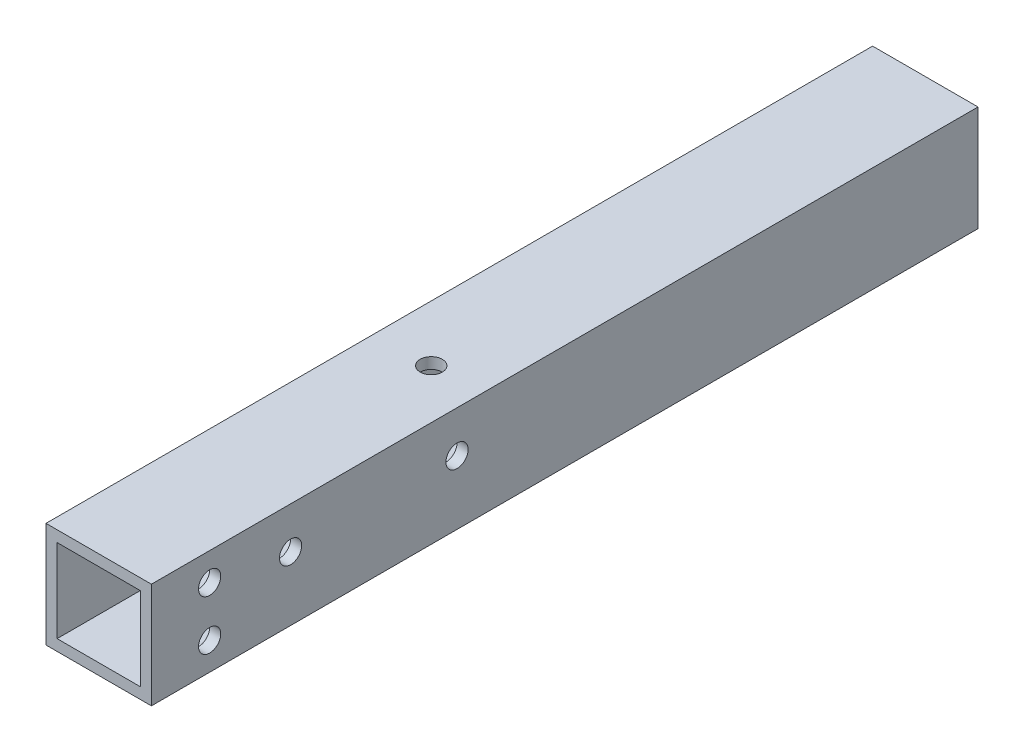
from build123d import *

# Parameters (mm, degrees)
SKETCH1_W           = 19
SKETCH1_H           = 19
SKETCH1_W_2         = 15
SKETCH1_H_2         = 15
BOSS_EXTRUDE1_DEPTH = 149
SKETCH2_R           = 2
CUT_EXTRUDE1_DEPTH  = 10
SKETCH5_R           = 2
CUT_EXTRUDE2_DEPTH  = 151.506644372
SKETCH6_R           = 2
CUT_EXTRUDE3_DEPTH  = 151.506644372


with BuildPart() as part:
    # Sketch1 → Boss-Extrude1 (new body)
    with BuildSketch(Plane.XY):
        Rectangle(SKETCH1_W, SKETCH1_H)
        Rectangle(SKETCH1_W_2, SKETCH1_H_2, mode=Mode.SUBTRACT)
    extrude(amount=BOSS_EXTRUDE1_DEPTH)

    # Sketch2 → Cut-Extrude1 (cut)
    with BuildSketch(Plane(origin=(9.5, 0, 0), x_dir=(0, 0, -1), z_dir=(1, 0, 0))):
        with Locations((-138.5, 4.5)):
            Circle(SKETCH2_R)
        with Locations((-138.5, -4.5)):
            Circle(SKETCH2_R)
    extrude(amount=-CUT_EXTRUDE1_DEPTH, mode=Mode.SUBTRACT)

    # Sketch5 → Cut-Extrude2 (cut, through all)
    with BuildSketch(Plane(origin=(0, 9.5, 0), x_dir=(1, 0, 0), z_dir=(0, 1, 0))):
        with Locations(Location((0.61, -89.67, 0), (0, 0, 270))):
            Circle(SKETCH5_R)
    extrude(amount=-CUT_EXTRUDE2_DEPTH, mode=Mode.SUBTRACT)

    # Sketch6 → Cut-Extrude3 (cut, through all)
    with BuildSketch(Plane.ZY.offset(9.5)):
        with Locations((93.91, 2)):
            Circle(SKETCH6_R)
        with Locations((123.91, 2)):
            Circle(SKETCH6_R)
    extrude(amount=-CUT_EXTRUDE3_DEPTH, mode=Mode.SUBTRACT)


solid = part.part
